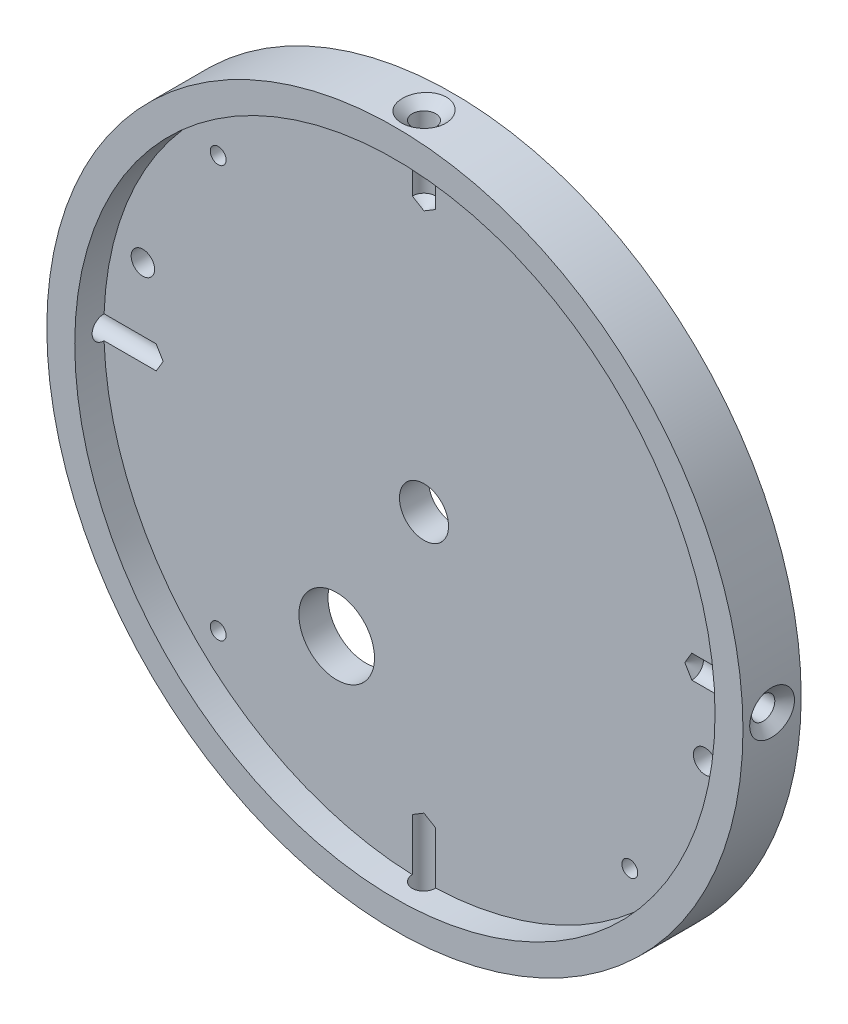
from build123d import *

# Parameters (mm, degrees)
SKETCH1_R           = 75.946
BOSS_EXTRUDE1_DEPTH = 12.7
SKETCH2_R           = 69.85
CUT_EXTRUDE1_DEPTH  = 6.35
SKETCH3_R           = 5.35813
SKETCH3_R_2         = 8.2499962
SKETCH3_R_3         = 2.5527
SKETCH3_R_4         = 1.7272
CUT_EXTRUDE2_DEPTH  = 108.59141384
CIRPATTERN1_COUNT   = 4


with BuildPart() as part:
    # Sketch1 → Boss-Extrude1 (new body)
    with BuildSketch(Plane.XY):
        Circle(SKETCH1_R)
    extrude(amount=BOSS_EXTRUDE1_DEPTH)

    # Sketch2 → Cut-Extrude1 (cut)
    with BuildSketch(Plane.XY.offset(12.7)):
        Circle(SKETCH2_R)
    extrude(amount=-CUT_EXTRUDE1_DEPTH, mode=Mode.SUBTRACT)

    # Sketch3 → Cut-Extrude2 (cut, through all)
    with BuildSketch(Plane.XY.offset(6.35)):
        Circle(SKETCH3_R)
        with Locations((-19.05, -32.995567884)):
            Circle(SKETCH3_R_2)
        with Locations((-61.336289969, 16.435009364)):
            Circle(SKETCH3_R_3)
        with Locations((61.336289969, -16.435009364)):
            Circle(SKETCH3_R_3)
        with Locations((44.901280605, 44.901280605)):
            Circle(SKETCH3_R_4)
        with Locations((-44.901280605, 44.901280605)):
            Circle(SKETCH3_R_4)
        with Locations((-44.901280605, -44.901280605)):
            Circle(SKETCH3_R_4)
        with Locations((44.901280605, -44.901280605)):
            Circle(SKETCH3_R_4)
    extrude(amount=-CUT_EXTRUDE2_DEPTH, mode=Mode.SUBTRACT)

    # Sketch5 → CSK for #10 Flat Head Machine Screw (100)1 (revolve, cut)
    with BuildSketch(Plane(origin=(0, 75.946, 6.35), x_dir=(0, 0, 1), z_dir=(1, 0, 0))):
        Polygon((0, 0), (0, 19.05), (2.5527, 17.516183098), (2.5527, 1.960808018), (4.8895, 0), align=None)
    csk_for_10_flat_head_machine_screw_100 = revolve(axis=Axis((0, 82.296, 6.35), (0, -1, 0)), mode=Mode.SUBTRACT)

    # CirPattern1: CSK for #10 Flat Head Machine Screw (100)1 ×4 about axis
    cirpattern1_axis = Axis((0, 0, 12.7), (0, 0, 1))
    for i in range(1, CIRPATTERN1_COUNT):
        add(csk_for_10_flat_head_machine_screw_100.rotate(cirpattern1_axis, i * 360 / CIRPATTERN1_COUNT), mode=Mode.SUBTRACT)


solid = part.part
